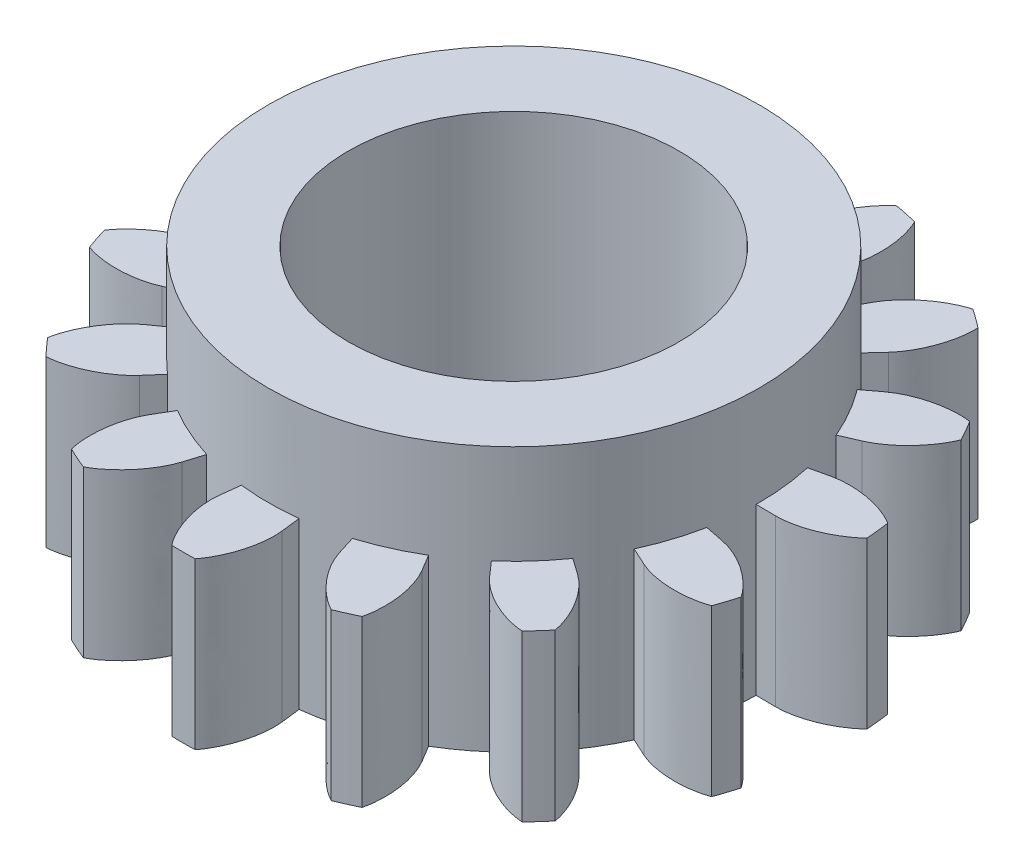
from build123d import *

# Parameters (mm, degrees)
SKETCH2_R               = 7.420012251
BOSS_EXTRUDE1_DEPTH     = 5
CUT_EXTRUDE1_DEPTH      = 15.984422762
CUT_EXTRUDE1_DEPTH_BACK = 15.984422762
SKETCH4_R               = 2.5
SKETCH5_R               = 5
SKETCH5_R_2             = 2.5
CUT_EXTRUDE2_DEPTH      = 5
BOSS_EXTRUDE2_START     = -5
SKETCH5_3_R             = 7.420012251
SKETCH5_3_R_2           = 5
BOSS_EXTRUDE2_DEPTH     = 8


with BuildPart() as part:
    # Sketch2 → Boss-Extrude1 (new body)
    with BuildSketch(Plane(origin=(0, 0, 0), x_dir=(1, 0, 0), z_dir=(0, 1, 0))):
        Circle(SKETCH2_R)
        with BuildLine():
            ThreePointArc((-4.886954955, -5.583390822), (-5.509338042, -4.970289341), (-6.055344702, -4.288284311))
            Line((-6.055344702, -4.288284311), (-6.539114387, -4.630881149))
            add(Edge.make_bspline(
                [(-6.539114387, -4.630881149), (-7.071519768, -5.007920897), (-7.543089872, -5.771178592), (-7.657112771, -6.431844527)],
                knots=[0, 0, 0, 0, 1, 1, 1, 1], degree=3))
            ThreePointArc((-7.657112771, -6.431844527), (-7.424971626, -6.698492095), (-7.183549977, -6.95676719))
            add(Edge.make_bspline(
                [(-5.277380401, -6.029455472), (-5.707057198, -6.520365149), (-6.514671642, -6.911133088), (-7.183549977, -6.95676719)],
                knots=[0, 0, 0, 0, 1, 1, 1, 1], degree=3))
            Line((-5.277380401, -6.029455472), (-4.886954955, -5.583390822))
        make_face()
        with BuildLine():
            ThreePointArc((-2.193485861, -7.088384977), (-3.011431942, -6.781434912), (-3.787630282, -6.38047323))
            Line((-3.787630282, -6.38047323), (-4.090229192, -6.890217874))
            add(Edge.make_bspline(
                [(-4.090229192, -6.890217874), (-4.423249828, -7.4512096), (-4.543605682, -8.340285041), (-4.379053739, -8.990210696)],
                knots=[0, 0, 0, 0, 1, 1, 1, 1], degree=3))
            ThreePointArc((-4.379053739, -8.990210696), (-4.058526913, -9.139385061), (-3.732927317, -9.277136069))
            add(Edge.make_bspline(
                [(-2.368726416, -7.654685647), (-2.561584747, -8.277919251), (-3.140437614, -8.963389914), (-3.732927317, -9.277136069)],
                knots=[0, 0, 0, 0, 1, 1, 1, 1], degree=3))
            Line((-2.368726416, -7.654685647), (-2.193485861, -7.088384977))
        make_face()
        with BuildLine():
            ThreePointArc((0.879256865, -7.367732973), (0.0071781, -7.420008779), (-0.865000176, -7.369420363))
            Line((-0.865000176, -7.369420363), (-0.934106211, -7.958173332))
            add(Edge.make_bspline(
                [(-0.934106211, -7.958173332), (-1.010159809, -8.60611647), (-0.758490792, -9.467280437), (-0.343816533, -9.994087762)],
                knots=[0, 0, 0, 0, 1, 1, 1, 1], degree=3))
            ThreePointArc((-0.343816533, -9.994087762), (0.009673973, -9.999995321), (0.363152388, -9.993403842))
            add(Edge.make_bspline(
                [(0.949501887, -7.956351133), (1.026808978, -8.604145911), (0.776806607, -9.465795194), (0.363152388, -9.993403842)],
                knots=[0, 0, 0, 0, 1, 1, 1, 1], degree=3))
            Line((0.949501887, -7.956351133), (0.879256865, -7.367732973))
        make_face()
        with BuildLine():
            Line((4.103552687, -6.882291227), (3.799968092, -6.373133005))
            ThreePointArc((3.799968092, -6.373133005), (3.024546983, -6.775595719), (2.207196318, -7.084127767))
            Line((2.207196318, -7.084127767), (2.38353222, -7.650088323))
            add(Edge.make_bspline(
                [(2.38353222, -7.650088323), (2.577596018, -8.272947619), (3.157774047, -8.957297038), (3.750869675, -9.269896261)],
                knots=[0, 0, 0, 0, 1, 1, 1, 1], degree=3))
            ThreePointArc((3.750869675, -9.269896261), (4.076202142, -9.131515542), (4.396439746, -8.981721303))
            add(Edge.make_bspline(
                [(4.103552687, -6.882291227), (4.437658102, -7.442637577), (4.559733908, -8.331478491), (4.396439746, -8.981721303)],
                knots=[0, 0, 0, 0, 1, 1, 1, 1], degree=3))
        make_face()
        with BuildLine():
            Line((6.548061948, -4.618220644), (6.063630314, -4.276560442))
            ThreePointArc((6.063630314, -4.276560442), (5.518944215, -4.959620605), (4.897748517, -5.573925121))
            Line((4.897748517, -5.573925121), (5.289036276, -6.019233544))
            add(Edge.make_bspline(
                [(5.289036276, -6.019233544), (5.719662077, -6.509310967), (6.528031065, -6.898515607), (7.19699644, -6.942855482)],
                knots=[0, 0, 0, 0, 1, 1, 1, 1], degree=3))
            ThreePointArc((7.19699644, -6.942855482), (7.437917929, -6.68411377), (7.669542731, -6.417017555))
            add(Edge.make_bspline(
                [(6.548061948, -4.618220644), (7.081195826, -4.994229592), (7.554241793, -5.756573468), (7.669542731, -6.417017555)],
                knots=[0, 0, 0, 0, 1, 1, 1, 1], degree=3))
        make_face()
        with BuildLine():
            Line((7.860351811, -1.555617757), (7.278835768, -1.440531727))
            ThreePointArc((7.278835768, -1.440531727), (7.059065855, -2.286082032), (6.741435503, -3.099940185))
            Line((6.741435503, -3.099940185), (7.280017911, -3.347598603))
            add(Edge.make_bspline(
                [(7.280017911, -3.347598603), (7.872746601, -3.620155314), (8.769532207, -3.646918156), (9.398697139, -3.415331916)],
                knots=[0, 0, 0, 0, 1, 1, 1, 1], degree=3))
            ThreePointArc((9.398697139, -3.415331916), (9.513550135, -3.080968003), (9.616512103, -2.742753174))
            add(Edge.make_bspline(
                [(7.860351811, -1.555617757), (8.50033046, -1.682273939), (9.242552644, -2.186304595), (9.616512103, -2.742753174)],
                knots=[0, 0, 0, 0, 1, 1, 1, 1], degree=3))
        make_face()
        with BuildLine():
            Line((7.813515436, 1.775965573), (7.235464392, 1.64457801))
            ThreePointArc((7.235464392, 1.64457801), (7.373730949, 0.827450111), (7.420012251, 0))
            ThreePointArc((7.420012251, 0), (7.419875948, -0.044974541), (7.419467047, -0.089947429))
            Line((7.419467047, -0.089947429), (8.012218312, -0.097133451))
            add(Edge.make_bspline(
                [(8.012218312, -0.097133451), (8.664561716, -0.105041918), (9.494701561, 0.235264576), (9.975277717, 0.702733565)],
                knots=[0, 0, 0, 0, 1, 1, 1, 1], degree=3))
            ThreePointArc((9.975277717, 0.702733565), (9.944203094, 1.054905122), (9.900699169, 1.405758147))
            add(Edge.make_bspline(
                [(7.813515436, 1.775965573), (8.449680735, 1.920562161), (9.332742177, 1.761996204), (9.900699169, 1.405758147)],
                knots=[0, 0, 0, 0, 1, 1, 1, 1], degree=3))
        make_face()
        with BuildLine():
            Line((6.41565126, 4.800468321), (5.94101549, 4.445325268))
            ThreePointArc((5.94101549, 4.445325268), (6.422327049, 3.716220806), (6.814605334, 2.935598055))
            Line((6.814605334, 2.935598055), (7.359033379, 3.170126957))
            add(Edge.make_bspline(
                [(7.359033379, 3.170126957), (7.958195396, 3.428234179), (8.578150759, 4.076767924), (8.827042156, 4.699290029)],
                knots=[0, 0, 0, 0, 1, 1, 1, 1], degree=3))
            ThreePointArc((8.827042156, 4.699290029), (8.655412999, 5.008375567), (8.472965403, 5.311201114))
            add(Edge.make_bspline(
                [(6.41565126, 4.800468321), (6.938004448, 5.191315615), (7.809215802, 5.405631852), (8.472965403, 5.311201114)],
                knots=[0, 0, 0, 0, 1, 1, 1, 1], degree=3))
        make_face()
        with BuildLine():
            Line((3.908462696, 6.994926486), (3.619311038, 6.477435404))
            ThreePointArc((3.619311038, 6.477435404), (4.355564527, 6.007132381), (5.03143645, 5.453551966))
            Line((5.03143645, 5.453551966), (5.433404719, 5.889243614))
            add(Edge.make_bspline(
                [(5.433404719, 5.889243614), (5.875784793, 6.368737442), (6.178359761, 7.213361063), (6.152530815, 7.883296555)],
                knots=[0, 0, 0, 0, 1, 1, 1, 1], degree=3))
            ThreePointArc((6.152530815, 7.883296555), (5.870023364, 8.095852377), (5.580178945, 8.298289157))
            add(Edge.make_bspline(
                [(3.908462696, 6.994926486), (4.226684162, 7.564443438), (4.93540507, 8.114584644), (5.580178945, 8.298289157)],
                knots=[0, 0, 0, 0, 1, 1, 1, 1], degree=3))
        make_face()
        with BuildLine():
            Line((0.725465425, 7.979898314), (0.671794827, 7.389538112))
            ThreePointArc((0.671794827, 7.389538112), (1.53568533, 7.259356195), (2.378286495, 7.028537198))
            Line((2.378286495, 7.028537198), (2.568291023, 7.590056549))
            add(Edge.make_bspline(
                [(2.568291023, 7.590056549), (2.77739762, 8.208028143), (2.710274231, 9.102698542), (2.414191002, 9.704209489)],
                knots=[0, 0, 0, 0, 1, 1, 1, 1], degree=3))
            ThreePointArc((2.414191002, 9.704209489), (2.069653362, 9.783482762), (1.722528853, 9.850527618))
            add(Edge.make_bspline(
                [(0.725465425, 7.979898314), (0.784531786, 8.62961027), (1.208217965, 9.420452033), (1.722528853, 9.850527618)],
                knots=[0, 0, 0, 0, 1, 1, 1, 1], degree=3))
        make_face()
        with BuildLine():
            add(Edge.make_bspline(
                [(-2.582971409, 7.585073229), (-2.793273263, 8.202639089), (-2.727881002, 9.097437683), (-2.432962126, 9.699520364)],
                knots=[0, 0, 0, 0, 1, 1, 1, 1], degree=3))
            Line((-2.582971409, 7.585073229), (-2.391880813, 7.023922549))
            ThreePointArc((-2.391880813, 7.023922549), (-1.549727812, 7.256371373), (-0.686090801, 7.388224497))
            Line((-0.686090801, 7.388224497), (-0.740903524, 7.978479752))
            add(Edge.make_bspline(
                [(-0.740903524, 7.978479752), (-0.801226833, 8.628076211), (-1.226442335, 9.418096748), (-1.741584368, 9.847176443)],
                knots=[0, 0, 0, 0, 1, 1, 1, 1], degree=3))
            ThreePointArc((-1.741584368, 9.847176443), (-2.088578509, 9.779460098), (-2.432962126, 9.699520364))
        make_face()
        with BuildLine():
            ThreePointArc((-5.041978531, 5.443806967), (-4.367178937, 5.998694019), (-3.631836765, 6.47042066))
            Line((-3.631836765, 6.47042066), (-3.92198912, 6.987351325))
            add(Edge.make_bspline(
                [(-3.92198912, 6.987351325), (-4.241311888, 7.556251518), (-4.95109588, 8.105020466), (-5.596223978, 8.28747713)],
                knots=[0, 0, 0, 0, 1, 1, 1, 1], degree=3))
            ThreePointArc((-5.596223978, 8.28747713), (-5.885676181, 8.084479939), (-6.167771851, 7.871377922))
            add(Edge.make_bspline(
                [(-5.444789021, 5.878720074), (-5.888095988, 6.35735709), (-6.192304562, 7.20139371), (-6.167771851, 7.871377922)],
                knots=[0, 0, 0, 0, 1, 1, 1, 1], degree=3))
            Line((-5.444789021, 5.878720074), (-5.041978531, 5.443806967))
        make_face()
        with BuildLine():
            ThreePointArc((-6.820272356, 2.922407705), (-6.429505148, 3.703787972), (-5.949605158, 4.433822309))
            Line((-5.949605158, 4.433822309), (-6.424927167, 4.788046375))
            add(Edge.make_bspline(
                [(-6.424927167, 4.788046375), (-6.948035587, 5.177882291), (-7.819659967, 5.390512513), (-8.483225623, 5.294797733)],
                knots=[0, 0, 0, 0, 1, 1, 1, 1], degree=3))
            ThreePointArc((-8.483225623, 5.294797733), (-8.665086972, 4.991619754), (-8.836117791, 4.682202728))
            add(Edge.make_bspline(
                [(-7.365153146, 3.155882812), (-7.964813426, 3.412830296), (-8.586022408, 4.060163342), (-8.836117791, 4.682202728)],
                knots=[0, 0, 0, 0, 1, 1, 1, 1], degree=3))
            Line((-7.365153146, 3.155882812), (-6.820272356, 2.922407705))
        make_face()
        with BuildLine():
            ThreePointArc((-7.41927913, -0.104302399), (-7.38011151, 0.768463338), (-7.238632768, 1.630575801))
            Line((-7.238632768, 1.630575801), (-7.816936939, 1.760844709))
            add(Edge.make_bspline(
                [(-7.816936939, 1.760844709), (-8.453380811, 1.904210177), (-9.336133808, 1.743935975), (-9.90340049, 1.386599706)],
                knots=[0, 0, 0, 0, 1, 1, 1, 1], degree=3))
            ThreePointArc((-9.90340049, 1.386599706), (-9.946225506, 1.035663166), (-9.976618691, 0.683432146))
            add(Edge.make_bspline(
                [(-8.012015382, -0.112635259), (-8.664342264, -0.121805861), (-9.495138978, 0.216893846), (-9.976618691, 0.683432146)],
                knots=[0, 0, 0, 0, 1, 1, 1, 1], degree=3))
            Line((-8.012015382, -0.112635259), (-7.41927913, -0.104302399))
        make_face()
        with BuildLine():
            ThreePointArc((-6.735425141, -3.11297767), (-7.054629545, -2.29973559), (-7.276035013, -1.454612077))
            Line((-7.276035013, -1.454612077), (-7.857327299, -1.570823004))
            add(Edge.make_bspline(
                [(-7.857327299, -1.570823004), (-8.497059697, -1.698717176), (-9.238305296, -2.204182935), (-9.611187442, -2.761354007)],
                knots=[0, 0, 0, 0, 1, 1, 1, 1], degree=3))
            ThreePointArc((-9.611187442, -2.761354007), (-9.507571291, -3.099368993), (-9.392071584, -3.433510063))
            add(Edge.make_bspline(
                [(-7.273527372, -3.36167767), (-7.865727612, -3.635380678), (-8.762459758, -3.663878565), (-9.392071584, -3.433510063)],
                knots=[0, 0, 0, 0, 1, 1, 1, 1], degree=3))
            Line((-7.273527372, -3.36167767), (-6.735425141, -3.11297767))
        make_face()
    extrude(amount=BOSS_EXTRUDE1_DEPTH)

    # Sketch4 → Cut-Extrude1 (cut, two sides: drawn at the far end of the back side and taken through both)
    with BuildSketch(Plane(origin=(0, 5, 0), x_dir=(1, 0, 0), z_dir=(0, 1, 0)).offset(-CUT_EXTRUDE1_DEPTH_BACK)):
        with Locations(Location((0, 0, 0), (0, 0, 270))):
            Circle(SKETCH4_R)
    extrude(amount=CUT_EXTRUDE1_DEPTH + CUT_EXTRUDE1_DEPTH_BACK, mode=Mode.SUBTRACT)

    # Sketch5 → Cut-Extrude2 (cut)
    with BuildSketch(Plane(origin=(0, 5, 0), x_dir=(1, 0, 0), z_dir=(0, 1, 0))):
        with Locations(Location((0, 0, 0), (0, 0, 270))):
            Circle(SKETCH5_R)
        Circle(SKETCH5_R_2, mode=Mode.SUBTRACT)
    extrude(amount=-CUT_EXTRUDE2_DEPTH, mode=Mode.SUBTRACT)

    # Sketch5<3> → Boss-Extrude2 (add)
    with BuildSketch(Plane(origin=(0, 5, 0), x_dir=(1, 0, 0), z_dir=(0, 1, 0)).offset(BOSS_EXTRUDE2_START)):
        with Locations(Location((0, 0, 0), (0, 0, 84.805427791))):
            Circle(SKETCH5_3_R)
        with Locations(Location((0, 0, 0), (0, 0, 270))):
            Circle(SKETCH5_3_R_2, mode=Mode.SUBTRACT)
    extrude(amount=BOSS_EXTRUDE2_DEPTH)


solid = part.part
